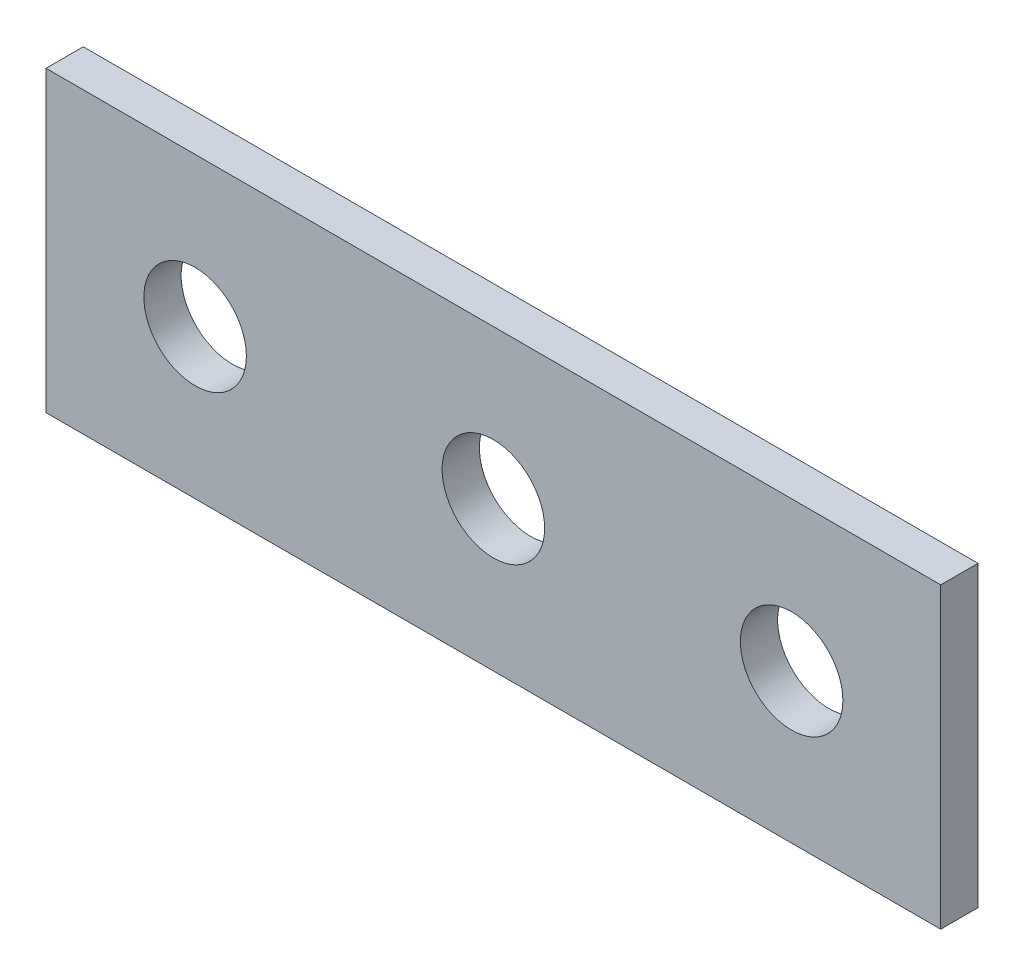
from build123d import *

# Parameters (mm, degrees)
SKETCH1_W                       = 152.4
SKETCH1_H                       = 50.8
BOSS_EXTRUDE1_DEPTH             = 6.35
F_11_16_0_6875_DIAMETER_HOLE1_D = 17.4625


with BuildPart() as part:
    # Sketch1 → Boss-Extrude1 (new body)
    with BuildSketch(Plane.XY):
        Rectangle(SKETCH1_W, SKETCH1_H)
    extrude(amount=BOSS_EXTRUDE1_DEPTH)

    # 11/16 (0.6875) Diameter Hole1 (through all)
    with Locations(Plane.XY.offset(6.35)):
        with Locations((0, 0), (50.8, 0), (-50.8, 0)):
            Hole(F_11_16_0_6875_DIAMETER_HOLE1_D / 2)


solid = part.part
